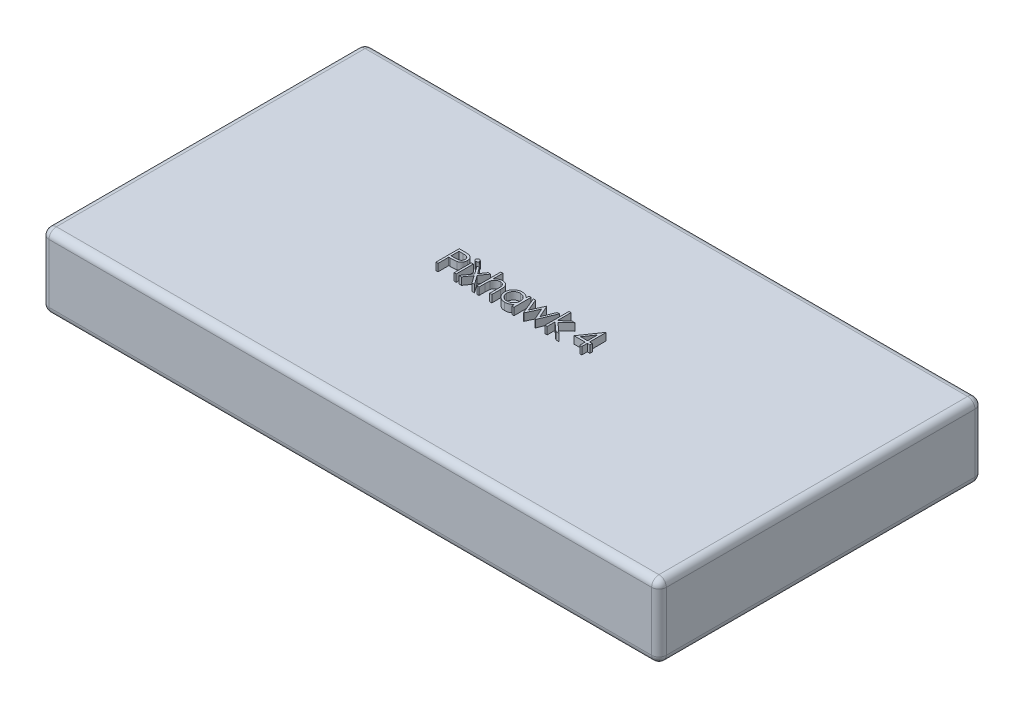
from build123d import *

# Parameters (mm, degrees)
SKETCH1_W           = 84
SKETCH1_H           = 44
BOSS_EXTRUDE1_DEPTH = 10
FILLET1_R           = 1
FILLET2_R           = 1
SKETCH2_W           = 0.284935898
SKETCH2_H           = 2.320192308
BOSS_EXTRUDE2_DEPTH = 1


with BuildPart() as part:
    # Sketch1 → Boss-Extrude1 (new body)
    with BuildSketch(Plane(origin=(0, 0, 0), x_dir=(1, 0, 0), z_dir=(0, 1, 0))):
        Rectangle(SKETCH1_W, SKETCH1_H)
    extrude(amount=BOSS_EXTRUDE1_DEPTH)

    # Fillet1
    fillet1_edges = [part.edges().sort_by_distance(p)[0] for p in [
        (42, 5, 22),
    ]]
    fillet(fillet1_edges, radius=FILLET1_R)

    # Fillet2
    fillet2_edges = [part.edges().sort_by_distance(p)[0] for p in [
        (-42, 10, 0),
        (-0.5, 10, 22),
        (42, 0, -0.5),
        (42, 10, -0.5),
        (41.707106781, 0, 21.707106781),
        (41.707106781, 10, 21.707106781),
        (-0.5, 0, 22),
        (-42, 0, 0),
        (0, 0, -22),
        (0, 10, -22),
        (-42, 5, 22),
        (-42, 5, -22),
        (42, 5, -22),
    ]]
    fillet(fillet2_edges, radius=FILLET2_R)

    # Sketch2 → Boss-Extrude2 (add)
    # profile 1 of 9: a face of its own
    with BuildSketch(Plane(origin=(0, 10, 0), x_dir=(1, 0, 0), z_dir=(0, 1, 0))):
        with BuildLine():
            Line((-10.001028205, 2.821327396), (-9.378366947, 2.821327396))
            add(Edge.make_bspline(
                [(-9.378366947, 2.821327396), (-9.335539911, 2.821280319), (-9.253481407, 2.821190117), (-9.135811321, 2.818455311), (-9.028941065, 2.814802526), (-8.933101076, 2.809738952), (-8.847996473, 2.803754902), (-8.774012351, 2.795361981), (-8.710567182, 2.786598713), (-8.672552046, 2.777689294), (-8.655214904, 2.773626074)],
                knots=[0, 0, 0, 0, 1.415646017, 2.712440637, 3.8905458, 4.950247383, 5.884950622, 6.709939814, 7.411656543, 8, 8, 8, 8], degree=3))
            add(Edge.make_bspline(
                [(-8.655214904, 2.773626074), (-8.633267912, 2.767619019), (-8.589891083, 2.755746459), (-8.527387994, 2.731966867), (-8.467921291, 2.703770903), (-8.411286949, 2.671636329), (-8.358180917, 2.634184424), (-8.307810865, 2.592933357), (-8.260621312, 2.54693072), (-8.21687762, 2.496692477), (-8.176704983, 2.443062001), (-8.142115913, 2.385238692), (-8.113153357, 2.324195867), (-8.088312818, 2.259975985), (-8.070434434, 2.192039763), (-8.056966175, 2.120859245), (-8.048417599, 2.046442062), (-8.047598846, 1.995587753), (-8.047182051, 1.969699792)],
                knots=[0, 0, 0, 0, 0.999701418, 1.975846123, 2.934577507, 3.890451536, 4.834027766, 5.787354733, 6.749476667, 7.726910423, 8.712836071, 9.690891519, 10.682875813, 11.679750201, 12.712814741, 13.765529915, 14.8625177, 16, 16, 16, 16], degree=3))
            add(Edge.make_bspline(
                [(-8.047182051, 1.969699792), (-8.047564344, 1.943594237), (-8.048312325, 1.892516956), (-8.057289669, 1.81779307), (-8.069382057, 1.746384245), (-8.087975812, 1.678448815), (-8.112328673, 1.614390223), (-8.140896463, 1.553229534), (-8.175352952, 1.49600726), (-8.214945047, 1.44251566), (-8.258988279, 1.392704526), (-8.307296302, 1.346934819), (-8.359674088, 1.305474455), (-8.41595518, 1.268230486), (-8.476688257, 1.236066576), (-8.540952211, 1.207258163), (-8.609305621, 1.183063701), (-8.65660633, 1.170336431), (-8.680655609, 1.163865457)],
                knots=[0, 0, 0, 0, 1.121902311, 2.195077645, 3.232258892, 4.234102512, 5.217864754, 6.176164875, 7.132989551, 8.084763148, 9.034132444, 9.988522005, 10.94243251, 11.903244335, 12.886203696, 13.894208494, 14.929344452, 16, 16, 16, 16], degree=3))
            add(Edge.make_bspline(
                [(-8.680655609, 1.163865457), (-8.700546833, 1.159635467), (-8.744139608, 1.150365198), (-8.815933363, 1.140016098), (-8.899522392, 1.131182703), (-8.994792603, 1.124559528), (-9.101658481, 1.118889551), (-9.220177836, 1.11438278), (-9.35058332, 1.111906413), (-9.441543663, 1.111778694), (-9.489034014, 1.111712011)],
                knots=[0, 0, 0, 0, 0.601384939, 1.31797006, 2.144135048, 3.087295005, 4.142315834, 5.309527816, 6.595305764, 8, 8, 8, 8], degree=3))
            Line((-9.489034014, 1.111712011), (-9.716092308, 1.111712011))
            Line((-9.716092308, 1.111712011), (-9.716092308, -0.353672604))
            Line((-9.716092308, -0.353672604), (-10.001028205, -0.353672604))
            Line((-10.001028205, -0.353672604), (-10.001028205, 2.821327396))
        make_face()
        with BuildLine():
            Line((-9.716092308, 2.49568637), (-9.716092308, 1.437353037))
            Line((-9.716092308, 1.437353037), (-9.160212901, 1.430356843))
            add(Edge.make_bspline(
                [(-9.160212901, 1.430356843), (-9.133071254, 1.430342815), (-9.080674864, 1.430315735), (-9.00498629, 1.433930902), (-8.934765008, 1.438104243), (-8.870226714, 1.444214688), (-8.811342317, 1.452851828), (-8.75801363, 1.461571048), (-8.710654166, 1.474185198), (-8.655228462, 1.491169696), (-8.593467139, 1.520137141), (-8.526277292, 1.562183112), (-8.469335403, 1.615777755), (-8.420060948, 1.676037287), (-8.380957758, 1.743074355), (-8.352331965, 1.814801176), (-8.335512487, 1.890482154), (-8.333257154, 1.942269251), (-8.332117949, 1.968427757)],
                knots=[0, 0, 0, 0, 1.160613943, 2.240541288, 3.23993089, 4.169200891, 5.011653406, 5.7853311, 6.478053781, 7.106038997, 8.262395093, 9.384106736, 10.481365981, 11.59014053, 12.70357646, 13.786202915, 14.881775077, 16, 16, 16, 16], degree=3))
            add(Edge.make_bspline(
                [(-8.332117949, 1.968427757), (-8.333263349, 1.993953408), (-8.335540264, 2.044695244), (-8.352463797, 2.119061691), (-8.380902104, 2.190032652), (-8.420323443, 2.256229665), (-8.468167182, 2.316272365), (-8.523774443, 2.368430474), (-8.58701433, 2.410360161), (-8.64584094, 2.437423209), (-8.698093445, 2.453947066), (-8.74347958, 2.465508457), (-8.794724691, 2.474739186), (-8.851845463, 2.482213592), (-8.914399162, 2.488612089), (-8.982923205, 2.492953654), (-9.05715801, 2.495494975), (-9.108693313, 2.495621027), (-9.135408213, 2.49568637)],
                knots=[0, 0, 0, 0, 1.120700087, 2.227813068, 3.331159281, 4.466773991, 5.599788987, 6.693661531, 7.80175334, 8.91857717, 9.525282508, 10.207424825, 10.974604443, 11.810962634, 12.737642355, 13.736264703, 14.826523623, 16, 16, 16, 16], degree=3))
            Line((-9.135408213, 2.49568637), (-9.716092308, 2.49568637))
        make_face(mode=Mode.SUBTRACT)
    # profile 2 of 9: a face of its own
    with BuildSketch(Plane(origin=(0, 10, 0), x_dir=(1, 0, 0), z_dir=(0, 1, 0))):
        with BuildLine():
            add(Edge.make_bspline(
                [(-7.376819471, 2.943442781), (-7.359138063, 2.942622585), (-7.324514471, 2.941016485), (-7.274446292, 2.92726286), (-7.228856003, 2.903949573), (-7.188417631, 2.872671577), (-7.153717705, 2.835887439), (-7.129423775, 2.793014989), (-7.113809673, 2.74669751), (-7.111924126, 2.714389536), (-7.110964103, 2.697939976)],
                knots=[0, 0, 0, 0, 1.055194115, 2.066272739, 3.074728998, 4.095836921, 5.109056067, 6.073838105, 7.019297344, 8, 8, 8, 8], degree=3))
            add(Edge.make_bspline(
                [(-7.110964103, 2.697939976), (-7.111945776, 2.681917427), (-7.113886429, 2.650242742), (-7.129411714, 2.604728235), (-7.153924744, 2.562451492), (-7.18839538, 2.525738777), (-7.228861899, 2.494478071), (-7.274444726, 2.471160201), (-7.324514883, 2.457407791), (-7.359138203, 2.455801523), (-7.376819471, 2.454981242)],
                knots=[0, 0, 0, 0, 0.96129708, 1.900370562, 2.859976407, 3.87933698, 4.906634145, 5.921202961, 6.938410037, 8, 8, 8, 8], degree=3))
            add(Edge.make_bspline(
                [(-7.376819471, 2.454981242), (-7.394298549, 2.455770203), (-7.428319291, 2.457305811), (-7.477637784, 2.471430042), (-7.522839342, 2.494486051), (-7.563356581, 2.52553409), (-7.597129685, 2.562676961), (-7.621711737, 2.604702435), (-7.637201167, 2.650249311), (-7.639146651, 2.681919633), (-7.640130769, 2.697939976)],
                knots=[0, 0, 0, 0, 1.054934014, 2.053291228, 3.073705704, 4.106921865, 5.123545215, 6.088680038, 7.033164197, 8, 8, 8, 8], degree=3))
            add(Edge.make_bspline(
                [(-7.640130769, 2.697939976), (-7.639168212, 2.714387247), (-7.637277689, 2.746690724), (-7.621700127, 2.793041218), (-7.597334444, 2.835660152), (-7.563334218, 2.872876141), (-7.522845294, 2.903941643), (-7.477636246, 2.926993033), (-7.428319698, 2.941118462), (-7.394298687, 2.942653905), (-7.376819471, 2.943442781)],
                knots=[0, 0, 0, 0, 0.98631895, 1.937192651, 2.907499808, 3.917963147, 4.944918757, 5.95915025, 6.951458133, 8, 8, 8, 8], degree=3))
        make_face()
    # profile 3 of 9: a face of its own
    with BuildSketch(Plane(origin=(0, 10, 0), x_dir=(1, 0, 0), z_dir=(0, 1, 0))):
        with Locations((-7.375547436, 0.80642355)):
            Rectangle(SKETCH2_W, SKETCH2_H)
    # profile 4 of 9: a face of its own
    with BuildSketch(Plane(origin=(0, 10, 0), x_dir=(1, 0, 0), z_dir=(0, 1, 0))):
        Polygon((-6.744617949, 1.966519704), (-6.405620553, 1.966519704), (-5.8084, 1.129520505), (-5.211179447, 1.966519704), (-4.872182051, 1.966519704), (-5.638583293, 0.89228593), (-4.750066667, -0.353672604), (-5.089064062, -0.353672604), (-5.8084, 0.654415337), (-6.527735937, -0.353672604), (-6.866733333, -0.353672604), (-5.977580689, 0.89228593), align=None)
    # profile 5 of 9: a face of its own
    with BuildSketch(Plane(origin=(0, 10, 0), x_dir=(1, 0, 0), z_dir=(0, 1, 0))):
        with BuildLine():
            Line((-4.424425641, 2.902737652), (-4.139489744, 2.902737652))
            Line((-4.139489744, 2.902737652), (-4.139489744, 1.528303558))
            add(Edge.make_bspline(
                [(-4.139489744, 1.528303558), (-4.108903334, 1.56653417), (-4.049350028, 1.640971131), (-3.949114265, 1.738090926), (-3.846179974, 1.822272532), (-3.736991896, 1.88928359), (-3.62355321, 1.942221311), (-3.505385475, 1.979765819), (-3.382466737, 2.0028536), (-3.29898678, 2.005755022), (-3.256697276, 2.007224832)],
                knots=[0, 0, 0, 0, 1.125788106, 2.19196713, 3.20547328, 4.180437432, 5.132270164, 6.079753143, 7.027236121, 8, 8, 8, 8], degree=3))
            add(Edge.make_bspline(
                [(-3.256697276, 2.007224832), (-3.213761848, 2.005641477), (-3.129726859, 2.00254247), (-3.007370104, 1.978037475), (-2.893105596, 1.936166085), (-2.78727301, 1.878864569), (-2.692182034, 1.807497076), (-2.607954034, 1.725099909), (-2.539155595, 1.629601426), (-2.492347825, 1.54137611), (-2.461891948, 1.462873097), (-2.442613505, 1.395529975), (-2.426267518, 1.320489383), (-2.412025615, 1.237789947), (-2.402533652, 1.147034684), (-2.394909463, 1.048633039), (-2.389487965, 0.942590654), (-2.389277866, 0.869184427), (-2.389169231, 0.831228237)],
                knots=[0, 0, 0, 0, 1.235656852, 2.418478516, 3.575258207, 4.727955599, 5.870717718, 6.98870536, 8.107142894, 9.245821548, 9.854588956, 10.528768408, 11.260415777, 12.065282286, 12.943670737, 13.886611085, 14.907229059, 16, 16, 16, 16], degree=3))
            Line((-2.389169231, 0.831228237), (-2.389169231, -0.353672604))
            Line((-2.389169231, -0.353672604), (-2.674105128, -0.353672604))
            Line((-2.674105128, -0.353672604), (-2.674105128, 0.737733646))
            add(Edge.make_bspline(
                [(-2.674105128, 0.737733646), (-2.67427776, 0.769322782), (-2.674607976, 0.829747423), (-2.675699582, 0.916258107), (-2.678136363, 0.994722458), (-2.682074112, 1.064889007), (-2.686215498, 1.126855575), (-2.691915364, 1.180532175), (-2.698546791, 1.225992528), (-2.704505614, 1.253356156), (-2.707178045, 1.265628277)],
                knots=[0, 0, 0, 0, 1.430932559, 2.737130458, 3.918967929, 4.986496826, 5.920444988, 6.731744033, 7.431208747, 8, 8, 8, 8], degree=3))
            add(Edge.make_bspline(
                [(-2.707178045, 1.265628277), (-2.717541467, 1.301636645), (-2.737465086, 1.370862522), (-2.783772894, 1.464899137), (-2.841611426, 1.545076724), (-2.912230013, 1.610313256), (-2.994379386, 1.661486581), (-3.088595211, 1.696926641), (-3.193990758, 1.718922789), (-3.268241736, 1.721135585), (-3.306942668, 1.722288935)],
                knots=[0, 0, 0, 0, 1.090059168, 2.095632401, 3.037101401, 3.955032261, 4.878929692, 5.839099886, 6.873700383, 8, 8, 8, 8], degree=3))
            add(Edge.make_bspline(
                [(-3.306942668, 1.722288935), (-3.329864148, 1.721857292), (-3.375225165, 1.721003083), (-3.442488597, 1.712427046), (-3.507738534, 1.698412852), (-3.571603366, 1.679449449), (-3.632729553, 1.653645283), (-3.692898819, 1.623772897), (-3.750406423, 1.587207552), (-3.806273557, 1.54618132), (-3.858268748, 1.500760895), (-3.90664406, 1.452821157), (-3.949768125, 1.401771725), (-3.98883749, 1.34843162), (-4.022563506, 1.292069207), (-4.052003088, 1.233228004), (-4.076981898, 1.171830629), (-4.089394055, 1.129217538), (-4.095604527, 1.107895906)],
                knots=[0, 0, 0, 0, 1.024319606, 2.027102035, 3.025350316, 4.005802111, 5.00026367, 5.987881639, 7.005602596, 8.042517216, 9.083927026, 10.089214625, 11.084353441, 12.06828073, 13.041928858, 14.016821737, 15.00770877, 16, 16, 16, 16], degree=3))
            add(Edge.make_bspline(
                [(-4.095604527, 1.107895906), (-4.099178151, 1.092455472), (-4.106965515, 1.058808865), (-4.1154154, 1.003315014), (-4.122978973, 0.93882952), (-4.129373014, 0.86545019), (-4.133294671, 0.782908134), (-4.137520361, 0.691766621), (-4.139093359, 0.591454745), (-4.139353667, 0.521699535), (-4.139489744, 0.485234648)],
                knots=[0, 0, 0, 0, 0.607992626, 1.324890765, 2.152360218, 3.099583803, 4.150613268, 5.323148443, 6.60066238, 8, 8, 8, 8], degree=3))
            Line((-4.139489744, 0.485234648), (-4.139489744, -0.353672604))
            Line((-4.139489744, -0.353672604), (-4.424425641, -0.353672604))
            Line((-4.424425641, -0.353672604), (-4.424425641, 2.902737652))
        make_face()
    # profile 6 of 9: a face of its own
    with BuildSketch(Plane(origin=(0, 10, 0), x_dir=(1, 0, 0), z_dir=(0, 1, 0))):
        with BuildLine():
            Line((0.623010256, 1.966519704), (0.623010256, -0.353672604))
            Line((0.623010256, -0.353672604), (0.338074359, -0.353672604))
            Line((0.338074359, -0.353672604), (0.338074359, 0.047654519))
            add(Edge.make_bspline(
                [(0.338074359, 0.047654519), (0.305944456, 0.011332888), (0.243242546, -0.059549233), (0.138520961, -0.152152347), (0.027515542, -0.228695538), (-0.089234942, -0.290517248), (-0.211625063, -0.336955756), (-0.339383513, -0.3699632), (-0.472562409, -0.391184751), (-0.563505616, -0.393303856), (-0.609591907, -0.394377732)],
                knots=[0, 0, 0, 0, 1.074387032, 2.096679803, 3.090159297, 4.057316773, 5.018401886, 5.985159533, 6.978961417, 8, 8, 8, 8], degree=3))
            add(Edge.make_bspline(
                [(-0.609591907, -0.394377732), (-0.650565694, -0.393265237), (-0.731367815, -0.391071348), (-0.850229907, -0.374051258), (-0.96461359, -0.34671848), (-1.074626952, -0.308708388), (-1.179558113, -0.258288642), (-1.280305486, -0.197926224), (-1.376347143, -0.126043471), (-1.466219182, -0.043867189), (-1.548979639, 0.045391121), (-1.621606651, 0.140591724), (-1.68216123, 0.241322957), (-1.732798018, 0.346309461), (-1.771801845, 0.456359424), (-1.798992213, 0.571092283), (-1.815992475, 0.690372383), (-1.818185457, 0.771597522), (-1.819297436, 0.812783726)],
                knots=[0, 0, 0, 0, 1.033919861, 2.038935746, 3.024066025, 3.998881131, 4.97069526, 5.957263378, 6.95902576, 7.993208707, 9.027059324, 10.027763471, 11.009749337, 11.988697705, 12.965288445, 13.950418724, 14.960734635, 16, 16, 16, 16], degree=3))
            add(Edge.make_bspline(
                [(-1.819297436, 0.812783726), (-1.818160812, 0.853118657), (-1.815913767, 0.93285864), (-1.799174061, 1.050132888), (-1.771024503, 1.163088738), (-1.731520384, 1.271362537), (-1.680863753, 1.375085297), (-1.619243275, 1.474330377), (-1.546654497, 1.569371187), (-1.462968385, 1.657972943), (-1.372313272, 1.739815929), (-1.275331781, 1.810944134), (-1.174436375, 1.87237299), (-1.068062073, 1.921044358), (-0.957783342, 1.960422617), (-0.842618431, 1.987666809), (-0.723046499, 2.003720808), (-0.641865838, 2.006045601), (-0.60068766, 2.007224832)],
                knots=[0, 0, 0, 0, 1.020392517, 2.01726096, 2.990465484, 3.961182959, 4.928053699, 5.906110375, 6.912531644, 7.948652711, 8.985773172, 9.998621852, 10.987621588, 11.969261332, 12.953316658, 13.946091881, 14.958173133, 16, 16, 16, 16], degree=3))
            add(Edge.make_bspline(
                [(-0.60068766, 2.007224832), (-0.553334931, 2.005920586), (-0.460478464, 2.003363021), (-0.32465377, 1.982078975), (-0.196161993, 1.946121223), (-0.07401126, 1.89721035), (0.041359791, 1.832214717), (0.148858927, 1.750227181), (0.249611187, 1.651764819), (0.308013309, 1.576135915), (0.338074359, 1.537207805)],
                knots=[0, 0, 0, 0, 1.038897134, 2.037228247, 3.008116434, 3.962042015, 4.918381754, 5.904844433, 6.921570401, 8, 8, 8, 8], degree=3))
            Line((0.338074359, 1.537207805), (0.338074359, 1.966519704))
            Line((0.338074359, 1.966519704), (0.623010256, 1.966519704))
        make_face()
        with BuildLine():
            add(Edge.make_bspline(
                [(-0.596871554, 1.722288935), (-0.638522418, 1.720806992), (-0.720734598, 1.717881872), (-0.841424514, 1.695045916), (-0.956915968, 1.657050605), (-1.066631336, 1.605087738), (-1.168837504, 1.539747384), (-1.260181048, 1.460715843), (-1.34140907, 1.370149409), (-1.409724424, 1.26845678), (-1.465414375, 1.159438084), (-1.504573039, 1.045478772), (-1.530398714, 0.928634256), (-1.533037157, 0.84938382), (-1.534361538, 0.809603638)],
                knots=[0, 0, 0, 0, 1.031046209, 2.035121221, 3.029706178, 4.034933723, 5.034054252, 6.02443088, 7.017295772, 8.038157696, 9.050218397, 10.03989886, 11.016116709, 12, 12, 12, 12], degree=3))
            add(Edge.make_bspline(
                [(-1.534361538, 0.809603638), (-1.532669814, 0.770061184), (-1.529292996, 0.691131268), (-1.505026294, 0.574127459), (-1.464313838, 0.460141292), (-1.408758538, 0.350140248), (-1.339192814, 0.248010386), (-1.258558108, 0.15571756), (-1.166074638, 0.076352005), (-1.063633257, 0.009915063), (-0.954224598, -0.043753795), (-0.839168103, -0.081096911), (-0.720626631, -0.105206754), (-0.640024871, -0.108022958), (-0.599415625, -0.109441835)],
                knots=[0, 0, 0, 0, 0.979072187, 1.954306742, 2.945804271, 3.96968567, 4.997920485, 5.998718438, 6.996577872, 8.005894225, 9.015743152, 10.005417472, 10.995077863, 12, 12, 12, 12], degree=3))
            add(Edge.make_bspline(
                [(-0.599415625, -0.109441835), (-0.558189155, -0.10793601), (-0.476193794, -0.104941075), (-0.355145823, -0.082007356), (-0.237675393, -0.044117089), (-0.125382693, 0.008405691), (-0.020774488, 0.073499864), (0.073112872, 0.149706296), (0.152502358, 0.238337042), (0.219805654, 0.335742824), (0.272579068, 0.442524421), (0.311020207, 0.556220437), (0.333747679, 0.67683483), (0.33661219, 0.759261392), (0.338074359, 0.801335409)],
                knots=[0, 0, 0, 0, 1.01762866, 2.023962475, 3.030623092, 4.058876274, 5.077231937, 6.066672613, 7.034107872, 8.005628644, 8.981990164, 9.965428785, 10.961468474, 12, 12, 12, 12], degree=3))
            add(Edge.make_bspline(
                [(0.338074359, 0.801335409), (0.337203814, 0.833391869), (0.335490305, 0.896489128), (0.322399717, 0.989133376), (0.301576319, 1.077791828), (0.272233722, 1.162557696), (0.233688057, 1.242962317), (0.187199012, 1.319583014), (0.131949068, 1.392021284), (0.068827623, 1.459279641), (-0.000265097, 1.520626503), (-0.073375859, 1.575385493), (-0.151370865, 1.620369594), (-0.232938463, 1.65759989), (-0.318220173, 1.687226405), (-0.40790995, 1.706990956), (-0.501054459, 1.720562104), (-0.564596238, 1.721707264), (-0.596871554, 1.722288935)],
                knots=[0, 0, 0, 0, 1.050140795, 2.067009409, 3.05949893, 4.030605086, 5.00011959, 5.97591094, 6.962425594, 7.979863591, 8.993523472, 9.986985069, 10.967611495, 11.937549037, 12.921786183, 13.919465291, 14.943216303, 16, 16, 16, 16], degree=3))
        make_face(mode=Mode.SUBTRACT)
    # profile 7 of 9: a face of its own
    with BuildSketch(Plane(origin=(0, 10, 0), x_dir=(1, 0, 0), z_dir=(0, 1, 0))):
        Polygon((0.948651282, 1.966519704), (1.254575761, 1.966519704), (1.945926923, 0.297609447), (2.703423918, 1.966519704), (2.751761258, 1.966519704), (3.492721795, 0.297609447), (4.190433133, 1.966519704), (4.489997436, 1.966519704), (3.520070553, -0.353672604), (3.460920913, -0.353672604), (2.719324359, 1.315237652), (1.962463381, -0.353672604), (1.909673918, -0.353672604), align=None)
    # profile 8 of 9: a face of its own
    with BuildSketch(Plane(origin=(0, 10, 0), x_dir=(1, 0, 0), z_dir=(0, 1, 0))):
        Polygon((4.85634359, 2.902737652), (5.141279487, 2.902737652), (5.141279487, 1.020125473), (6.19706875, 1.966519704), (6.606664103, 1.966519704), (5.381694151, 0.867481242), (6.728779487, -0.353672604), (6.319820152, -0.353672604), (5.141279487, 0.715473029), (5.141279487, -0.353672604), (4.85634359, -0.353672604), align=None)
    # profile 9 of 9: a face of its own
    with BuildSketch(Plane(origin=(0, 10, 0), x_dir=(1, 0, 0), z_dir=(0, 1, 0))):
        Polygon((9.805196755, 2.902737652), (9.863074359, 2.902737652), (9.863074359, 0.704660729), (10.229420513, 0.704660729), (10.229420513, 0.379019704), (9.863074359, 0.379019704), (9.863074359, -0.353672604), (9.578138462, -0.353672604), (9.578138462, 0.379019704), (8.072048718, 0.379019704), align=None)
        Polygon((9.578138462, 0.704660729), (9.578138462, 2.083546947), (8.631744231, 0.704660729), align=None, mode=Mode.SUBTRACT)
    extrude(amount=BOSS_EXTRUDE2_DEPTH)


solid = part.part
